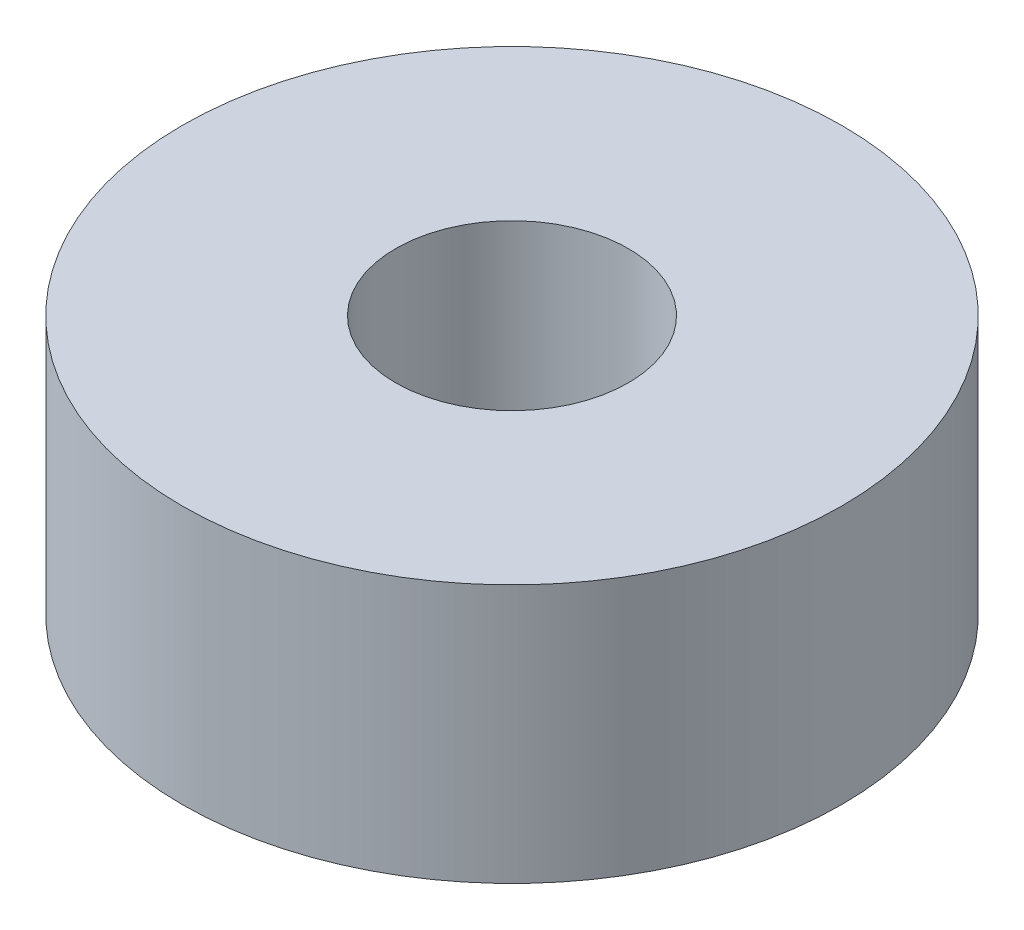
from build123d import *

# Parameters (mm, degrees)
SKETCH1_R           = 12.75
BOSS_EXTRUDE1_DEPTH = 10
SKETCH2_R           = 4.5
CUT_EXTRUDE1_DEPTH  = 7
SKETCH3_R           = 2.5
CUT_EXTRUDE2_DEPTH  = 7


with BuildPart() as part:
    # Sketch1 → Boss-Extrude1 (new body)
    with BuildSketch(Plane(origin=(0, 0, 0), x_dir=(1, 0, 0), z_dir=(0, 1, 0))):
        with Locations(Location((0, 0, 0), (0, 0, 270))):
            Circle(SKETCH1_R)
    extrude(amount=BOSS_EXTRUDE1_DEPTH)

    # Sketch2 → Cut-Extrude1 (cut)
    with BuildSketch(Plane(origin=(0, 10, 0), x_dir=(1, 0, 0), z_dir=(0, 1, 0))):
        with Locations(Location((0, 0, 0), (0, 0, 270))):
            Circle(SKETCH2_R)
    extrude(amount=-CUT_EXTRUDE1_DEPTH, mode=Mode.SUBTRACT)

    # Sketch3 → Cut-Extrude2 (cut)
    with BuildSketch(Plane.XZ):
        with Locations(Location((0, 8.5, 0), (0, 0, 270))):
            Circle(SKETCH3_R)
    extrude(amount=-CUT_EXTRUDE2_DEPTH, mode=Mode.SUBTRACT)


solid = part.part
